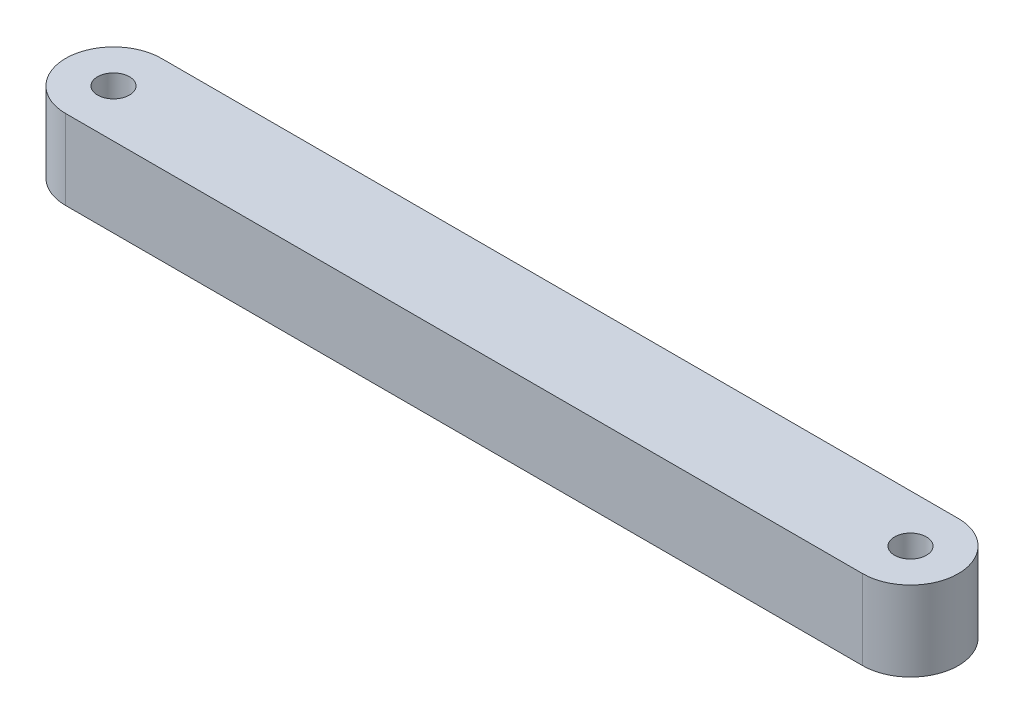
from build123d import *

# Parameters (mm, degrees)
BOSS_EXTRUDE1_DEPTH = 12.7
SKETCH4_R           = 2.54
CUT_EXTRUDE3_DEPTH  = 73.645776202


with BuildPart() as part:
    # Sketch3 → Boss-Extrude1 (new body)
    with BuildSketch(Plane(origin=(0, 0, 0), x_dir=(1, 0, 0), z_dir=(0, 1, 0))):
        with BuildLine():
            Line((-63.5, 7.62), (63.5, 7.62))
            ThreePointArc((63.5, 7.62), (71.12, 0), (63.5, -7.62))
            Line((63.5, -7.62), (-63.5, -7.62))
            ThreePointArc((-63.5, -7.62), (-71.12, 0), (-63.5, 7.62))
        make_face()
    extrude(amount=BOSS_EXTRUDE1_DEPTH)

    # Sketch4 → Cut-Extrude3 (cut, through all)
    with BuildSketch(Plane(origin=(0, 12.7, 0), x_dir=(1, 0, 0), z_dir=(0, 1, 0))):
        with Locations(Location((-63.5, 0, 0), (0, 0, 270))):
            Circle(SKETCH4_R)
        with Locations(Location((63.5, 0, 0), (0, 0, 90))):
            Circle(SKETCH4_R)
    extrude(amount=-CUT_EXTRUDE3_DEPTH, mode=Mode.SUBTRACT)


solid = part.part
